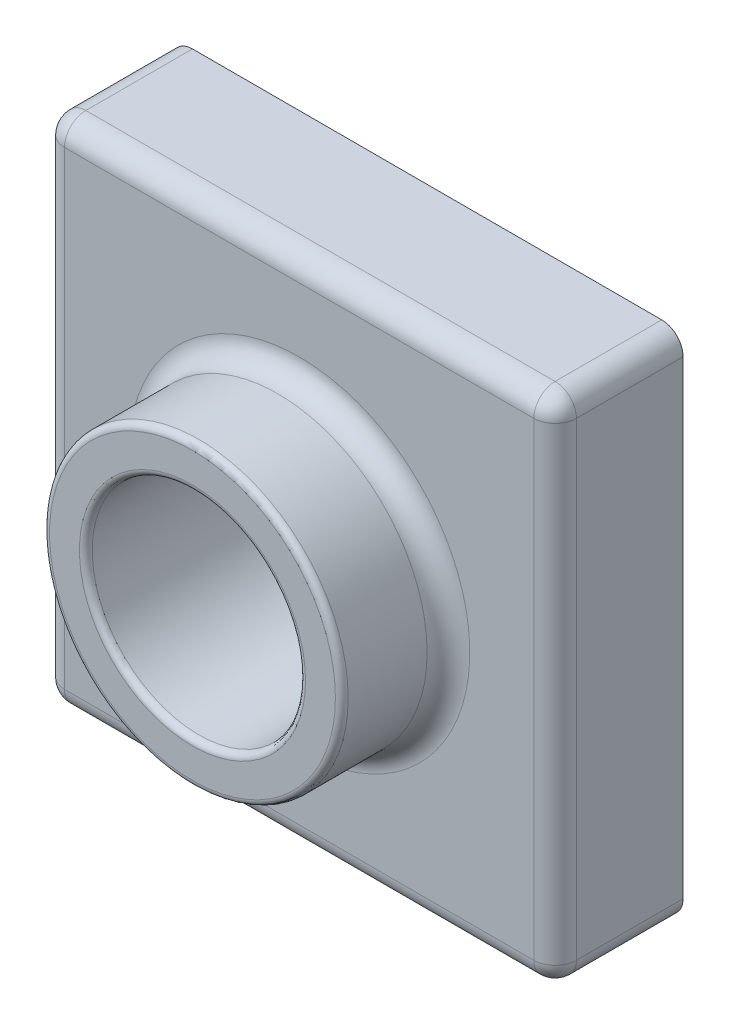
from build123d import *

# Parameters (mm, degrees)
SKETCH1_W           = 120
SKETCH1_H           = 120
BOSS_EXTRUDE1_DEPTH = 30
SKETCH2_R           = 35
BOSS_EXTRUDE2_DEPTH = 25
SKETCH3_R           = 25
CUT_EXTRUDE3_DEPTH  = 102.118742081
FILLET1_R           = 5
FILLET2_R           = 1.5
SHELL1_T            = -2


with BuildPart() as part:
    # Sketch1 → Boss-Extrude1 (new body)
    with BuildSketch(Plane.XY):
        Rectangle(SKETCH1_W, SKETCH1_H)
    extrude(amount=BOSS_EXTRUDE1_DEPTH)

    # Sketch2 → Boss-Extrude2 (add)
    with BuildSketch(Plane.XY.offset(30)):
        Circle(SKETCH2_R)
    extrude(amount=BOSS_EXTRUDE2_DEPTH)

    # Sketch3 → Cut-Extrude3 (cut, through all)
    with BuildSketch(Plane.XY.offset(55)):
        Circle(SKETCH3_R)
    extrude(amount=-CUT_EXTRUDE3_DEPTH, mode=Mode.SUBTRACT)

    # Fillet1
    fillet1_edges = [part.edges().sort_by_distance(p)[0] for p in [
        (-60, 0, 30),
        (-35, 0, 30),
        (0, -60, 30),
        (60, 0, 30),
        (60, -60, 15),
        (-60, -60, 15),
        (-60, 60, 15),
        (60, 60, 15),
        (0, 60, 30),
    ]]
    fillet(fillet1_edges, radius=FILLET1_R)

    # Fillet2
    fillet2_edges = [part.edges().sort_by_distance(p)[0] for p in [
        (-35, 0, 55),
        (-25, 0, 55),
    ]]
    fillet(fillet2_edges, radius=FILLET2_R)

    # Shell1
    shell1_openings = [part.faces().sort_by_distance(p)[0] for p in [
        (0, -58.302943725, 0),
    ]]
    offset(amount=SHELL1_T, openings=shell1_openings, kind=Kind.INTERSECTION)


solid = part.part
